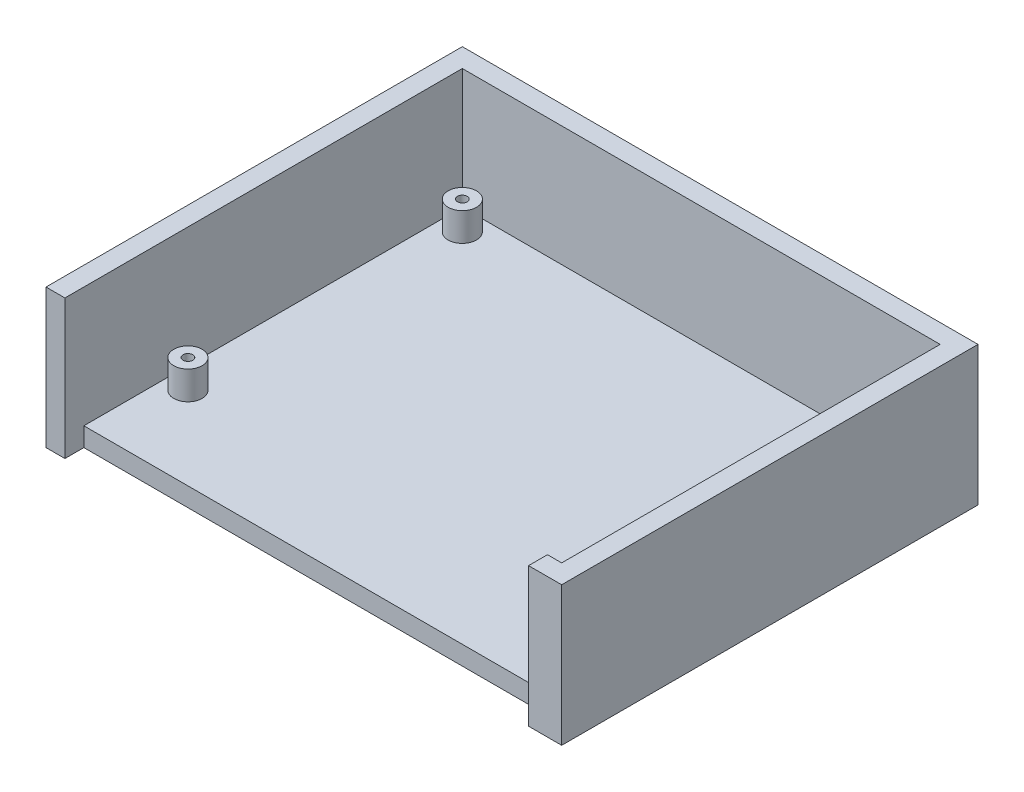
from build123d import *

# Parameters (mm, degrees)
SKETCH2_W                = 101
SKETCH2_H                = 80
BOSS_EXTRUDE1_DEPTH      = 4
BOSS_EXTRUDE2_DEPTH      = 29.4
SKETCH9_R                = 3
BOSS_EXTRUDE3_DEPTH      = 6
M2_5X0_45_TAPPED_HOLE1_D = 2.05


with BuildPart() as part:
    # Sketch2 → Boss-Extrude1 (new body)
    with BuildSketch(Plane(origin=(0, 0, 0), x_dir=(1, 0, 0), z_dir=(0, 1, 0))):
        Rectangle(SKETCH2_W, SKETCH2_H)
    extrude(amount=BOSS_EXTRUDE1_DEPTH)

    # Sketch3 → Boss-Extrude2 (add)
    with BuildSketch(Plane.XZ):
        Polygon((50.5, -40), (-50.5, -40), (-50.5, 40), (-50.5, 44), (-54.5, 44), (-54.5, -44), (54.5, -44), (54.5, 44), (47.5, 44), (47.5, 40), (50.5, 40), align=None)
    extrude(amount=-BOSS_EXTRUDE2_DEPTH)

    # Sketch9 → Boss-Extrude3 (add)
    with BuildSketch(Plane(origin=(0, 4, 0), x_dir=(1, 0, 0), z_dir=(0, 1, 0))):
        with Locations(Location((-46, -22.5, 0), (0, 0, 270))):
            Circle(SKETCH9_R)
        with Locations(Location((-46, 35.5, 0), (0, 0, 270))):
            Circle(SKETCH9_R)
        with Locations(Location((40, 35.5, 0), (0, 0, 270))):
            Circle(SKETCH9_R)
        with Locations(Location((40, -22.5, 0), (0, 0, 270))):
            Circle(SKETCH9_R)
    extrude(amount=BOSS_EXTRUDE3_DEPTH)

    # M2.5x0.45 Tapped Hole1 (through all)
    with Locations(Plane(origin=(0, 10, 0), x_dir=(1, 0, 0), z_dir=(0, 1, 0))):
        with Locations((-46, -22.5), (-46, 35.5), (40, 35.5), (40, -22.5)):
            Hole(M2_5X0_45_TAPPED_HOLE1_D / 2)


solid = part.part
